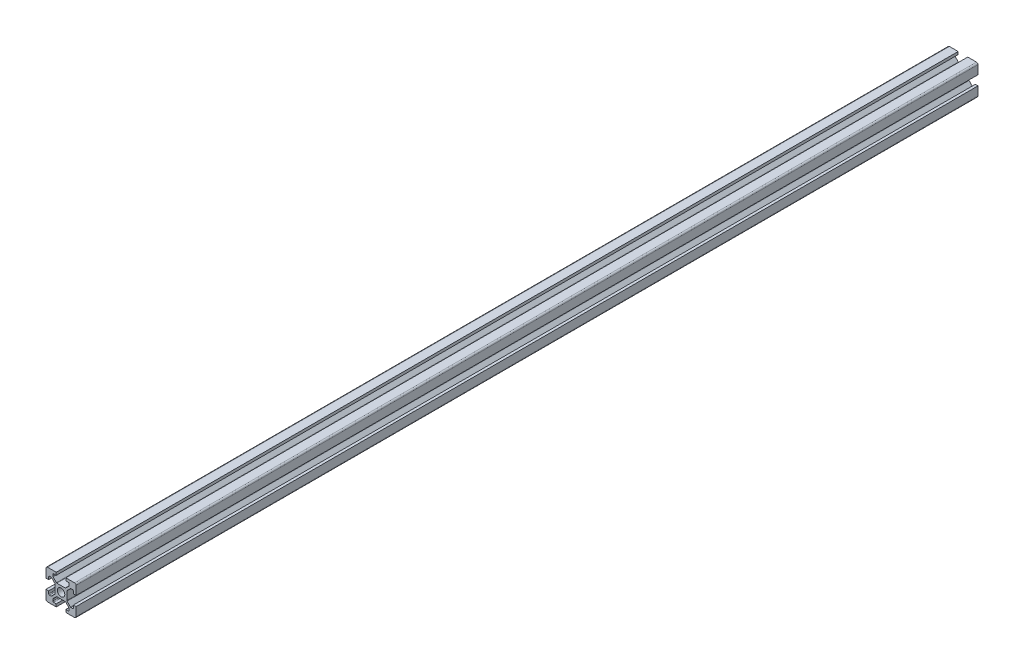
from build123d import *

# Parameters (mm, degrees)
SKETCH1_R           = 2.5
BOSS_EXTRUDE1_DEPTH = 600
FILLET1_R           = 1
FILLET2_R           = 0.5
FILLET3_R           = 0.5
FILLET4_R           = 0.5
FILLET5_R           = 0.5
CUT_EXTRUDE1_REACH  = 602.813
SKETCH2_R           = 2.5


with BuildPart() as part:
    # Sketch1 → Boss-Extrude1 (new body)
    with BuildSketch(Plane.XY):
        Polygon((13.2, 0), (13.2, 1.8), (15.45, 1.8), (15.45, 3.6), (12.95, 6.1), (7.05, 6.1), (4.55, 3.6), (4.55, 1.8), (6.8, 1.8), (6.8, 0), (0, 0), (0, 6.8), (1.8, 6.8), (1.8, 4.55), (3.6, 4.55), (6.1, 7.05), (6.1, 12.95), (3.6, 15.45), (1.8, 15.45), (1.8, 13.2), (0, 13.2), (0, 20), (6.8, 20), (6.8, 18.2), (4.55, 18.2), (4.55, 16.4), (7.05, 13.9), (12.95, 13.9), (15.45, 16.4), (15.45, 18.2), (13.2, 18.2), (13.2, 20), (20, 20), (20, 13.2), (18.2, 13.2), (18.2, 15.45), (16.4, 15.45), (13.9, 12.95), (13.9, 7.05), (16.4, 4.55), (18.2, 4.55), (18.2, 6.8), (20, 6.8), (20, 0), align=None)
        with Locations((10, 10)):
            Circle(SKETCH1_R, mode=Mode.SUBTRACT)
    extrude(amount=BOSS_EXTRUDE1_DEPTH)

    # Fillet1
    fillet1_edges = [part.edges().sort_by_distance(p)[0] for p in [
        (0, 0, 300),
        (0, 20, 300),
        (20, 20, 300),
        (20, 0, 300),
    ]]
    fillet(fillet1_edges, radius=FILLET1_R)

    # Fillet2
    fillet2_edges = [part.edges().sort_by_distance(p)[0] for p in [
        (4.55, 18.2, 300),
        (4.55, 16.4, 300),
        (7.05, 13.9, 300),
        (12.95, 13.9, 300),
        (15.45, 16.4, 300),
        (15.45, 18.2, 300),
    ]]
    fillet(fillet2_edges, radius=FILLET2_R)

    # Fillet3
    fillet3_edges = [part.edges().sort_by_distance(p)[0] for p in [
        (18.2, 15.45, 300),
        (16.4, 15.45, 300),
        (13.9, 12.95, 300),
        (13.9, 7.05, 300),
        (16.4, 4.55, 300),
        (18.2, 4.55, 300),
    ]]
    fillet(fillet3_edges, radius=FILLET3_R)

    # Fillet4
    fillet4_edges = [part.edges().sort_by_distance(p)[0] for p in [
        (1.8, 4.55, 300),
        (3.6, 4.55, 300),
        (6.1, 7.05, 300),
        (6.1, 12.95, 300),
        (3.6, 15.45, 300),
        (1.8, 15.45, 300),
    ]]
    fillet(fillet4_edges, radius=FILLET4_R)

    # Fillet5
    fillet5_edges = [part.edges().sort_by_distance(p)[0] for p in [
        (15.45, 1.8, 300),
        (15.45, 3.6, 300),
        (12.95, 6.1, 300),
        (7.05, 6.1, 300),
        (4.55, 3.6, 300),
        (4.55, 1.8, 300),
    ]]
    fillet(fillet5_edges, radius=FILLET5_R)

    # Cut-Extrude1: up to this face of the body (flat: up to its plane)
    cut_extrude1_end = Plane(part.part.faces().sort_by_distance((10, 6.1, 300))[0])
    # Sketch2 → Cut-Extrude1 (cut, up to the picked face)
    with BuildSketch(Plane(origin=(0, 24, 0), x_dir=(1, 0, 0), z_dir=(0, 1, 0)), mode=Mode.PRIVATE) as cut_extrude1_sk1:
        with Locations((10, -10)):
            Circle(SKETCH2_R)
    cut_extrude1_tool1 = split(extrude(cut_extrude1_sk1.sketch, amount=-CUT_EXTRUDE1_REACH, mode=Mode.PRIVATE), bisect_by=cut_extrude1_end, keep=Keep.BOTH, mode=Mode.PRIVATE)
    # Sketch2 → Cut-Extrude1 (cut, up to the picked face)
    with BuildSketch(Plane(origin=(0, 24, 0), x_dir=(1, 0, 0), z_dir=(0, 1, 0)), mode=Mode.PRIVATE) as cut_extrude1_sk2:
        with Locations((10, -390)):
            Circle(SKETCH2_R)
    cut_extrude1_tool2 = split(extrude(cut_extrude1_sk2.sketch, amount=-CUT_EXTRUDE1_REACH, mode=Mode.PRIVATE), bisect_by=cut_extrude1_end, keep=Keep.BOTH, mode=Mode.PRIVATE)
    add(cut_extrude1_tool1.solids().sort_by(Axis((10, 24, 10), (0, -1, 0)))[0], mode=Mode.SUBTRACT)
    add(cut_extrude1_tool2.solids().sort_by(Axis((10, 24, 390), (0, -1, 0)))[0], mode=Mode.SUBTRACT)


solid = part.part
